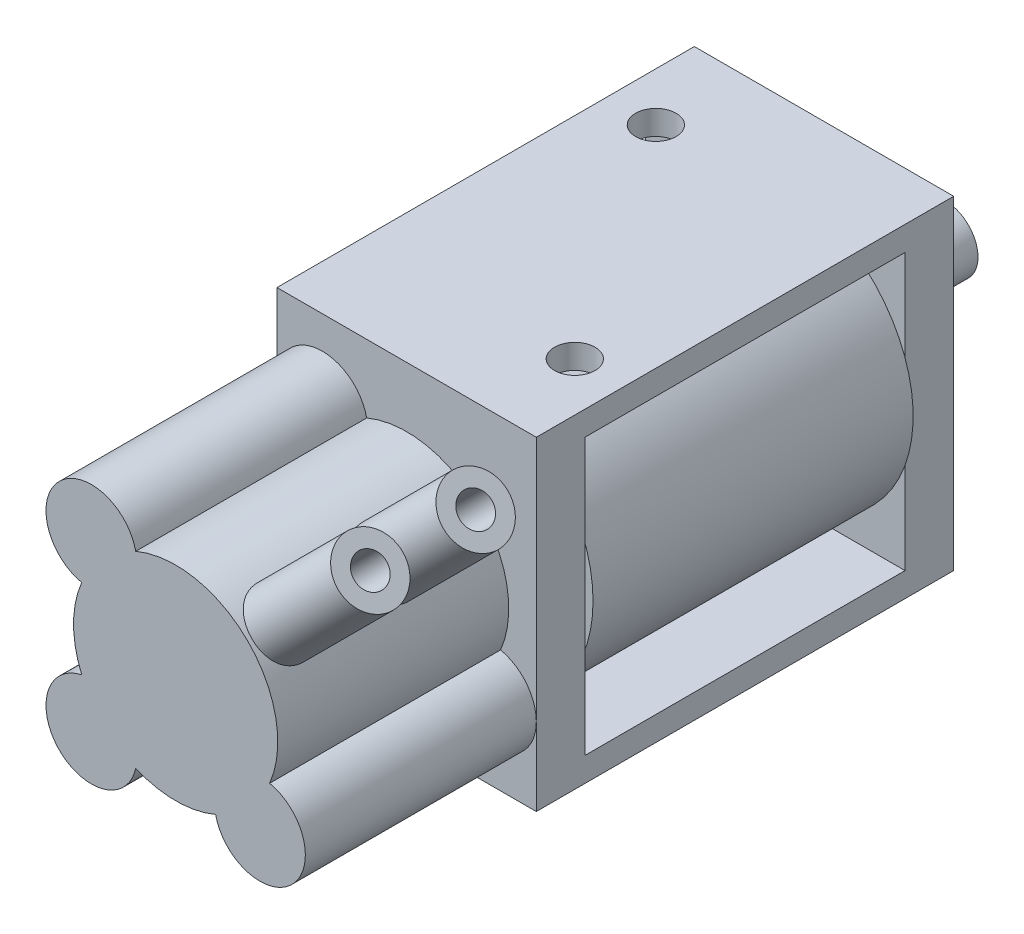
from build123d import *
from build123d.topology import SkipClean

# Parameters (mm, degrees)
FRAME_EXTRUDE_DEPTH                      = 8
FRAME_EXTRUDE_DEPTH_BACK                 = 8
FRAME_SKETCH_W                           = 25.75
FRAME_SKETCH_H                           = 20
FRAME_SKETCH_W_2                         = 19.75
FRAME_SKETCH_H_2                         = 17
ELECTROMAGNET_EXTRUDE_REACH              = 20.159
ELECTROMAGNET_SKETCH_R                   = 8.5
ELECTROMAGNET_EXTRUDE_DIRECTION_2_REACH  = 20.159
PORT_3_SKETCH_R                          = 2
PORT_3_SKETCH_R_2                        = 1
PORT_3_EXTRUDE_DEPTH                     = 7.5
PORT_3_SKETCH_3_R                        = 1
CENTER_HOLE_CUT_DEPTH                    = 29.901773302
BASE_OF_PORT_1_2_PORTS_DEPTH             = 14.25
PORTS_1_2_SKETCH_R                       = 2
PORTS_1_2_SKETCH_R_2                     = 1
PORTS_1_2_EXTRUDE_DEPTH                  = 7.5
PORTS_1_2_EXTRUDE_DIRECTION_2_REACH      = 35.355
PORTS_1_2_EXTRUDE_DIRECTION_2_END_RADIUS = 6.3
MOUNTING_HOLES_PROFILE_SKETCH_W          = 1.25
MOUNTING_HOLES_PROFILE_SKETCH_H          = 3.126136458
MOUNTING_HOLES_AT_2_COUNT                = 2
MOUNTING_HOLES_AT_2_PITCH                = 18.027756377


with BuildPart() as part:
    # Frame Sketch → Frame Extrude (new, two sides: drawn at the far end of the back side and taken through both)
    with BuildSketch(Plane(origin=(0, 0, 0), x_dir=(0, 0, -1), z_dir=(1, 0, 0)).offset(-FRAME_EXTRUDE_DEPTH_BACK)):
        Rectangle(FRAME_SKETCH_W, FRAME_SKETCH_H)
        Rectangle(FRAME_SKETCH_W_2, FRAME_SKETCH_H_2, mode=Mode.SUBTRACT)
    extrude(amount=FRAME_EXTRUDE_DEPTH + FRAME_EXTRUDE_DEPTH_BACK)


with BuildPart() as body_2:

    # Electromagnet Extrude: up to this face of the body (flat: up to its plane)
    electromagnet_extrude_end = Plane(part.part.faces().sort_by_distance((0, 0, 9.875))[0])
    # Electromagnet Sketch → Electromagnet Extrude (new, up to the picked face)
    with BuildSketch(Plane.XY, mode=Mode.PRIVATE) as electromagnet_extrude_sk1:
        with Locations(Location((0, 0, 0), (0, 0, 90))):
            Circle(ELECTROMAGNET_SKETCH_R)
    electromagnet_extrude_tool1 = split(extrude(electromagnet_extrude_sk1.sketch, amount=ELECTROMAGNET_EXTRUDE_REACH, mode=Mode.PRIVATE), bisect_by=electromagnet_extrude_end, keep=Keep.BOTH, mode=Mode.PRIVATE)
    add(electromagnet_extrude_tool1.solids().sort_by(Axis((0, 0, 0), (0, 0, 1)))[0])


    # Electromagnet Extrude direction 2: up to this face of the body (flat: up to its plane)
    electromagnet_extrude_direction_2_end = Plane(part.part.faces().sort_by_distance((0, 0, -9.875))[0])
    # Electromagnet Sketch → Electromagnet Extrude direction 2 (add, up to the picked face)
    with BuildSketch(Plane.XY, mode=Mode.PRIVATE) as electromagnet_extrude_direction_2_sk1:
        with Locations(Location((0, 0, 0), (0, 0, 90))):
            Circle(ELECTROMAGNET_SKETCH_R)
    electromagnet_extrude_direction_2_tool1 = split(extrude(electromagnet_extrude_direction_2_sk1.sketch, amount=-ELECTROMAGNET_EXTRUDE_DIRECTION_2_REACH, mode=Mode.PRIVATE), bisect_by=electromagnet_extrude_direction_2_end, keep=Keep.BOTH, mode=Mode.PRIVATE)
    add(electromagnet_extrude_direction_2_tool1.solids().sort_by(Axis((0, 0, 0), (0, 0, -1)))[0])


with BuildPart() as part_1:
    add(part.part)

    # Port 3 Sketch → Port 3 Extrude (add)
    with BuildSketch(Plane.XY.offset(-12.875)):
        Circle(PORT_3_SKETCH_R)
        Circle(PORT_3_SKETCH_R_2, mode=Mode.SUBTRACT)
    extrude(amount=-PORT_3_EXTRUDE_DEPTH)


with BuildPart() as center_hole_cut_tool:
    # Port 3 Sketch<3> → Center Hole Cut (new, through all)
    with BuildSketch(Plane.XY.offset(-12.875)):
        with Locations(Location((0, 0, 0), (0, 0, 90))):
            Circle(PORT_3_SKETCH_3_R)
    extrude(amount=CENTER_HOLE_CUT_DEPTH)


with BuildPart() as part_2:
    add(part_1.part)

    # Center Hole Cut: cut by center_hole_cut_tool
    add(center_hole_cut_tool.part, mode=Mode.SUBTRACT)

    # Mounting Holes Profile Sketch → Mounting Holes (revolve, cut)
    with BuildSketch(Plane(origin=(5, 10, 7.5), x_dir=(0, 0, 1), z_dir=(1, 0, 0))):
        with Locations((0.625, 1.563068229)):
            Rectangle(MOUNTING_HOLES_PROFILE_SKETCH_W, MOUNTING_HOLES_PROFILE_SKETCH_H)
    mounting_holes = revolve(axis=Axis((5, 16.35, 7.5), (0, -1, 0)), mode=Mode.SUBTRACT)

    # Mounting Holes at 2: Mounting Holes ×2
    with Locations(*[Vector(-0.5547001962252294, 0, -0.8320502943378435) * (i * MOUNTING_HOLES_AT_2_PITCH) for i in range(1, MOUNTING_HOLES_AT_2_COUNT)]):
        add(mounting_holes, mode=Mode.SUBTRACT)


with BuildPart() as body_2_1:
    add(body_2.part)

    # Center Hole Cut: cut by center_hole_cut_tool
    add(center_hole_cut_tool.part, mode=Mode.SUBTRACT)


with BuildPart() as body_3:
    # Base of Ports 1&2 Sketch → Base of Port 1&2 Ports (new body)
    with BuildSketch(Plane.XY.offset(12.875)):
        with BuildLine():
            ThreePointArc((-5.797915365, 2.464584635), (-6.3, 0), (-5.797915365, -2.464584635))
            ThreePointArc((-5.797915365, -2.464584635), (-7.179898987, -7.179898987), (-2.464584635, -5.797915365))
            ThreePointArc((-2.464584635, -5.797915365), (0, -6.3), (2.464584635, -5.797915365))
            ThreePointArc((2.464584635, -5.797915365), (7.179898987, -7.179898987), (5.797915365, -2.464584635))
            ThreePointArc((5.797915365, -2.464584635), (4.454772721, 4.454772721), (-2.464584635, 5.797915365))
            ThreePointArc((-2.464584635, 5.797915365), (-7.179898987, 7.179898987), (-5.797915365, 2.464584635))
        make_face()
    extrude(amount=BASE_OF_PORT_1_2_PORTS_DEPTH)

    # Ports 1&2 Sketch → Ports 1&2 Extrude (add)
    # profile 1 of 2: a face of its own
    with BuildSketch(Plane(origin=(4.454772721, 4.454772721, 0), x_dir=(0, 0, -1), z_dir=(0.7071067811865561, 0.7071067811865389, 0))):
        with Locations(Location((-24.875, 0, 0), (0, 0, 270))):
            Circle(PORTS_1_2_SKETCH_R)
        with Locations(Location((-24.875, 0, 0), (0, 0, 90))):
            Circle(PORTS_1_2_SKETCH_R_2, mode=Mode.SUBTRACT)
    # profile 2 of 2: a face of its own
    with BuildSketch(Plane(origin=(4.454772721, 4.454772721, 0), x_dir=(0, 0, -1), z_dir=(0.7071067811865561, 0.7071067811865389, 0))):
        with Locations(Location((-18.375, 0, 0), (0, 0, 270))):
            Circle(PORTS_1_2_SKETCH_R)
        with Locations(Location((-18.375, 0, 0), (0, 0, 90))):
            Circle(PORTS_1_2_SKETCH_R_2, mode=Mode.SUBTRACT)
    extrude(amount=PORTS_1_2_EXTRUDE_DEPTH)

    # Ports 1&2 Extrude direction 2: up to this cylinder (the profile starts outside it)
    with SkipClean():  # the faces are left unmerged after this step: merging them gives an invalid solid
        ports_1_2_extrude_direction_2_end = Plane(origin=(0, 0, 21.625), z_dir=(0, 0, -1)) * Cylinder(PORTS_1_2_EXTRUDE_DIRECTION_2_END_RADIUS, 90.81, mode=Mode.PRIVATE)
        # Ports 1&2 Sketch → Ports 1&2 Extrude direction 2 (add, up to the surface)
        with BuildSketch(Plane(origin=(4.454772721, 4.454772721, 0), x_dir=(0, 0, -1), z_dir=(0.7071067811865561, 0.7071067811865389, 0)), mode=Mode.PRIVATE) as ports_1_2_extrude_direction_2_sk1:
            with Locations(Location((-24.875, 0, 0), (0, 0, 270))):
                Circle(PORTS_1_2_SKETCH_R)
            with Locations(Location((-24.875, 0, 0), (0, 0, 90))):
                Circle(PORTS_1_2_SKETCH_R_2, mode=Mode.SUBTRACT)
        ports_1_2_extrude_direction_2_tool1 = extrude(ports_1_2_extrude_direction_2_sk1.sketch, amount=-PORTS_1_2_EXTRUDE_DIRECTION_2_REACH, mode=Mode.PRIVATE) - ports_1_2_extrude_direction_2_end
        add(ports_1_2_extrude_direction_2_tool1.solids().sort_by_distance((3.080559, 5.828986, 24.875))[0])
        add(ports_1_2_extrude_direction_2_tool1.solids().sort_by_distance((3.080559, 5.828986, 24.875))[1])
        # Ports 1&2 Sketch → Ports 1&2 Extrude direction 2 (add, up to the surface)
        with BuildSketch(Plane(origin=(4.454772721, 4.454772721, 0), x_dir=(0, 0, -1), z_dir=(0.7071067811865561, 0.7071067811865389, 0)), mode=Mode.PRIVATE) as ports_1_2_extrude_direction_2_sk2:
            with Locations(Location((-18.375, 0, 0), (0, 0, 270))):
                Circle(PORTS_1_2_SKETCH_R)
            with Locations(Location((-18.375, 0, 0), (0, 0, 90))):
                Circle(PORTS_1_2_SKETCH_R_2, mode=Mode.SUBTRACT)
        ports_1_2_extrude_direction_2_tool2 = extrude(ports_1_2_extrude_direction_2_sk2.sketch, amount=-PORTS_1_2_EXTRUDE_DIRECTION_2_REACH, mode=Mode.PRIVATE) - ports_1_2_extrude_direction_2_end
        add(ports_1_2_extrude_direction_2_tool2.solids().sort_by_distance((3.080559, 5.828986, 18.375))[0])
        add(ports_1_2_extrude_direction_2_tool2.solids().sort_by_distance((3.080559, 5.828986, 18.375))[1])


solid = Compound([part_2.part, body_2_1.part, body_3.part])
